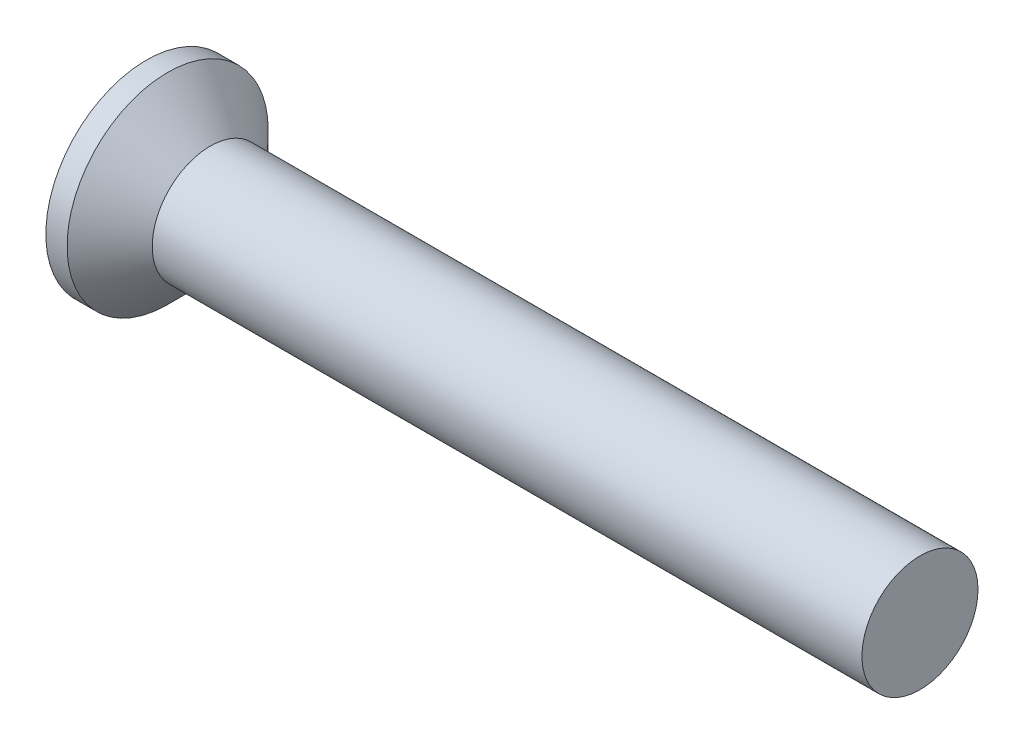
from build123d import *

# Parameters (mm, degrees)
CROSSRECESS_DEPTH = 0.825
DRAFT9_ANGLE      = 30
FILLET5_R         = 0.3


with BuildPart() as part:
    # Sketch1 → Base (revolve)
    with BuildSketch(Plane.XY, mode=Mode.PRIVATE) as base_sk:
        Polygon((20, 1.5), (2.65, 1.5), (1.65, 1.5), (0.55, 2.6), (0, 2.6), (0, 0), (20, 0), align=None)
    revolve(base_sk.sketch.rotate(Axis((4.515812911, 0, 0), (-1, 0, 0)), 90), axis=Axis((4.515812911, 0, 0), (-1, 0, 0)))

    # Sketch6 → CrossRecess (cut)
    with BuildSketch(Plane(origin=(0, 0, 0), x_dir=(0, 0, -1), z_dir=(1, 0, 0))):
        Polygon((0.32, 0.32), (0.32, 1.6), (-0.32, 1.6), (-0.32, 0.32), (-1.6, 0.32), (-1.6, -0.32), (-0.32, -0.32), (-0.32, -1.6), (0.32, -1.6), (0.32, -0.32), (1.6, -0.32), (1.6, 0.32), align=None)
    extrude(amount=CROSSRECESS_DEPTH, mode=Mode.SUBTRACT)

    # Draft9
    draft9_faces = [part.faces().sort_by_distance(p)[0] for p in [
        (0.4125, 1.6, 0),
        (0.4125, 0, 1.6),
        (0.4125, -1.6, 0),
        (0.4125, 0, -1.6),
    ]]
    draft(draft9_faces, Plane(origin=(0, 2.6, 0), x_dir=(0, 0, -1), z_dir=(-1, 0, 0)), DRAFT9_ANGLE)

    # Fillet5
    fillet5_edges = [part.edges().sort_by_distance(p)[0] for p in [
        (0.4125, 0.32, 0.32),
        (0.4125, -0.32, 0.32),
        (0.4125, -0.32, -0.32),
        (0.4125, 0.32, -0.32),
    ]]
    fillet(fillet5_edges, radius=FILLET5_R)


solid = part.part
